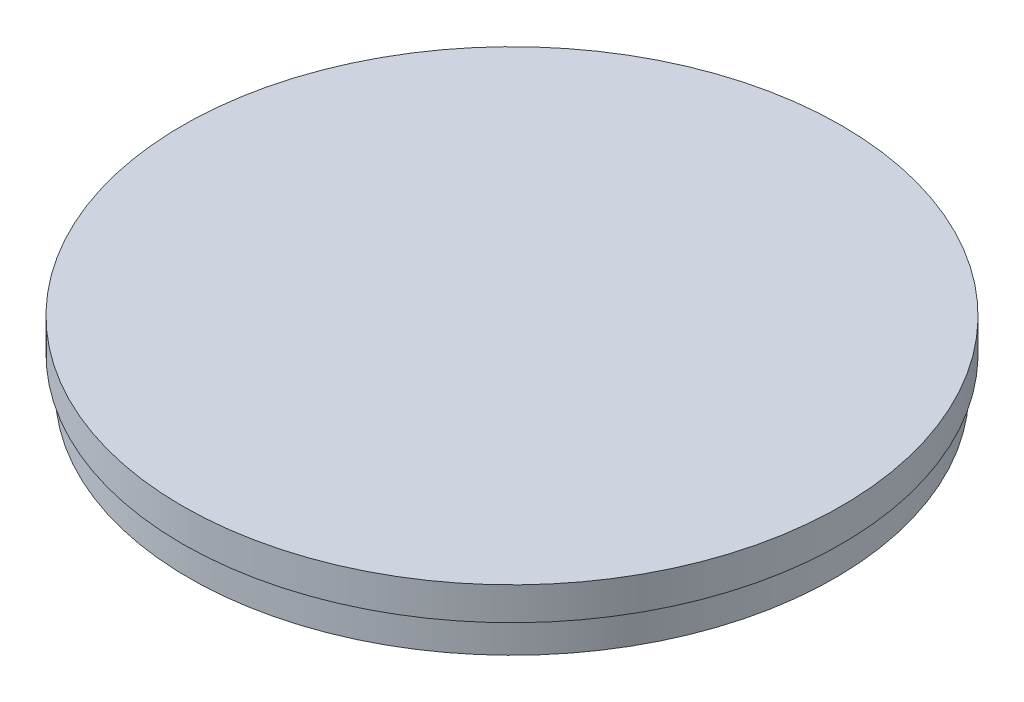
from build123d import *


with BuildPart() as part:
    # Sketch1 → Revolve1 (revolve)
    with BuildSketch(Plane.XY, mode=Mode.PRIVATE) as revolve1_sk:
        Polygon((0, 0), (0, 11.938), (59.944, 11.938), (59.944, 5.969), (58.7502, 5.969), (58.7502, 0), align=None)
    revolve(revolve1_sk.sketch.rotate(Axis((0, 0, 0), (0, 1, 0)), 90), axis=Axis((0, 0, 0), (0, 1, 0)))


solid = part.part
